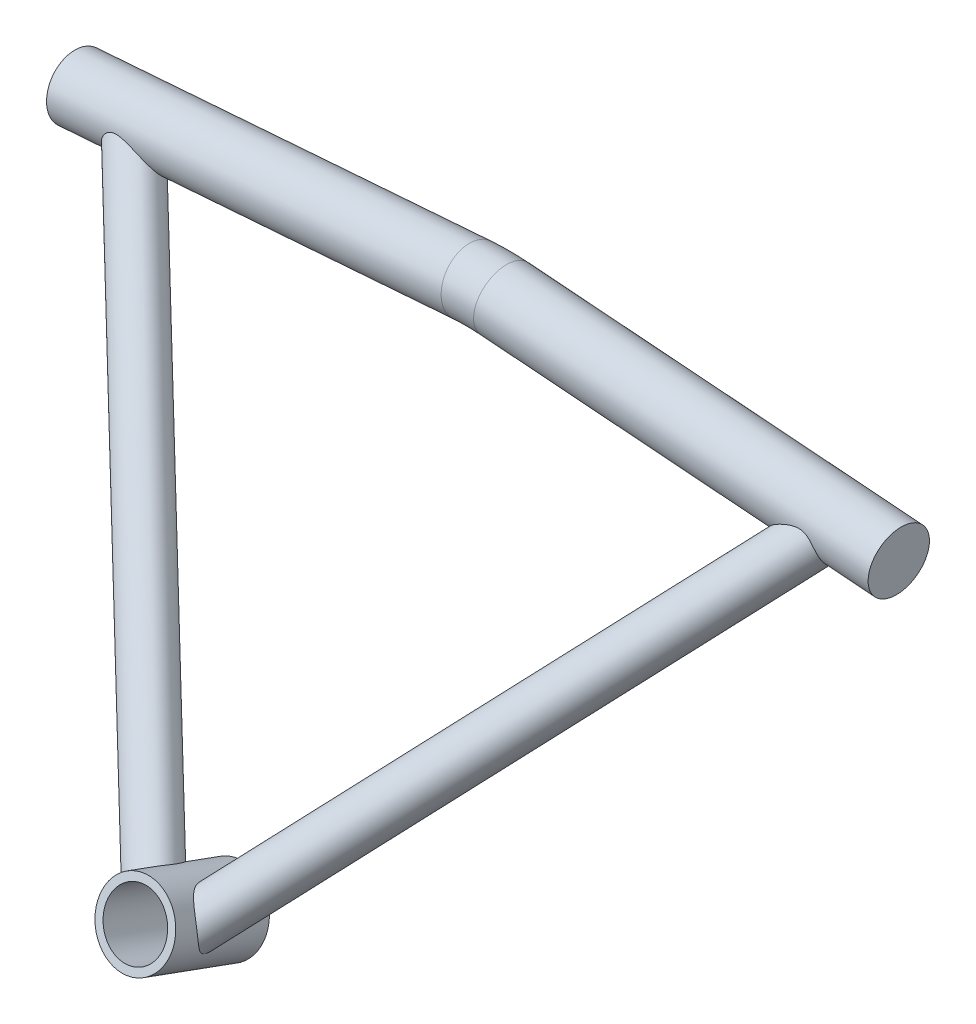
from build123d import *

# Parameters (mm, degrees)
SKETCH1_R               = 15.875
BOSS_EXTRUDE1_DEPTH     = 20.701
SWEEP1_PROFILE_R        = 9.525
SWEEP2_PROFILE_R        = 9.525
CUT_EXTRUDE2_REACH      = 371.805
SKETCH36_R              = 7.9375
CUT_EXTRUDE3_REACH      = 371.805
CUT_EXTRUDE3_END_RADIUS = 15.875
SKETCH37_R              = 7.9375
SKETCH77_R              = 15.875
BOSS_EXTRUDE2_DEPTH     = 41.402
CUT_EXTRUDE1_REACH      = 251.445
SKETCH2_R               = 12.7
SWEEP3_PROFILE_R        = 12.7


with BuildPart() as part:
    # Sketch1 → Boss-Extrude1 (new, symmetric)
    with BuildSketch(Plane(origin=(0, 0, 0), x_dir=(1, 0, 0), z_dir=(0, 0.34202014332566943, 0.9396926207859081))):
        with Locations(Location((0, 0, 0), (0, 0, 270))):
            Circle(SKETCH1_R)
    extrude(amount=BOSS_EXTRUDE1_DEPTH, both=True)

    # Sweep1: sweep along a path in Sketch4
    with BuildLine(Plane(origin=(0, 3.144101118, 3.616874596), x_dir=(1, 0, 0), z_dir=(0, 0.6560590289905084, 0.754709580222771))) as sweep1_path:
        Line((-5.08, -4.165974834), (-143.483994092, 193.495413453))
    # Sweep1 profile (on start of the path) → Sweep1 (sweep)
    with BuildSketch(Plane(origin=(-5.08, 0, 6.35), x_dir=(0.7330812283825076, 0.6801410975622587, 0), z_dir=(-0.5735764363510472, 0.6182218954839692, -0.5374120947718255))):
        Circle(SWEEP1_PROFILE_R)
    sweep(path=sweep1_path.line)

    # Sweep2: sweep along a path in Sketch15
    with BuildLine(Plane(origin=(0, 3.144101118, 3.616874596), x_dir=(1, 0, 0), z_dir=(0, 0.6560590289905084, 0.754709580222771))) as sweep2_path:
        Line((5.08, -4.165974834), (143.483994092, 193.495413453))
    # Sweep2 profile (on start of the path) → Sweep2 (sweep)
    with BuildSketch(Plane(origin=(5.08, 0, 6.35), x_dir=(0.7330812283825074, -0.6801410975622589, 0), z_dir=(0.5735764363510474, 0.6182218954839692, -0.5374120947718254))):
        Circle(SWEEP2_PROFILE_R)
    sweep(path=sweep2_path.line)

    # Sketch36 → Cut-Extrude2 (cut, up to next)
    with BuildSketch(Plane(origin=(-138.117895022, 148.868575223, -129.409478119), x_dir=(0.8191108775847741, 0.4394391101382058, -0.36871484741361205), z_dir=(-0.5735764363510472, 0.6182218954839691, -0.5374120947718255)), mode=Mode.PRIVATE) as cut_extrude2_sk1:
        with Locations(Location((-6.502422539, -4.857839146, 0), (0, 0, 154.073467295))):
            Circle(SKETCH36_R)
    cut_extrude2_tool1 = extrude(cut_extrude2_sk1.sketch, amount=-CUT_EXTRUDE2_REACH, mode=Mode.PRIVATE) & part.part
    add(cut_extrude2_tool1.solids().sort_by_distance((-143.483994, 149.176943, -123.327538))[0], mode=Mode.SUBTRACT)

    # Cut-Extrude3: up to this cylinder (the profile starts outside it)
    cut_extrude3_end = Plane(origin=(0, -22.186319293, -60.956411279), z_dir=(0, -0.34202014332566943, -0.9396926207859081)) * Cylinder(CUT_EXTRUDE3_END_RADIUS, 776.36, mode=Mode.PRIVATE)
    # Sketch37 → Cut-Extrude3 (cut, up to the surface)
    with BuildSketch(Plane(origin=(138.117895022, 148.868575223, -129.409478119), x_dir=(0.8191108775847737, -0.4394391101382061, 0.36871484741361227), z_dir=(0.5735764363510476, 0.6182218954839689, -0.5374120947718255)), mode=Mode.PRIVATE) as cut_extrude3_sk1:
        with Locations(Location((6.502422539, -4.857839146, 0), (0, 0, 205.926532705))):
            Circle(SKETCH37_R)
    cut_extrude3_tool1 = extrude(cut_extrude3_sk1.sketch, amount=-CUT_EXTRUDE3_REACH, mode=Mode.PRIVATE) - cut_extrude3_end
    add(cut_extrude3_tool1.solids().sort_by_distance((143.483994, 149.176943, -123.327538))[0], mode=Mode.SUBTRACT)

    # Sketch77 → Boss-Extrude2 (add)
    with BuildSketch(Plane(origin=(0, 7.080158987, 19.452576943), x_dir=(1, 0, 0), z_dir=(0, 0.34202014332566943, 0.9396926207859082))):
        with Locations(Location((0, 0, 0), (0, 0, 270))):
            Circle(SKETCH77_R)
    extrude(amount=-BOSS_EXTRUDE2_DEPTH)

    # Sketch2 → Cut-Extrude1 (cut, up to next)
    with BuildSketch(Plane(origin=(0, -7.080158987, -19.452576943), x_dir=(-1, 0, 0), z_dir=(0, -0.34202014332566943, -0.9396926207859081)), mode=Mode.PRIVATE) as cut_extrude1_sk1:
        with Locations(Location((0, 0, 0), (0, 0, 90))):
            Circle(SKETCH2_R)
    cut_extrude1_tool1 = extrude(cut_extrude1_sk1.sketch, amount=-CUT_EXTRUDE1_REACH, mode=Mode.PRIVATE) & part.part
    add(cut_extrude1_tool1.solids().sort_by_distance((0, -7.080159, -19.452577))[0], mode=Mode.SUBTRACT)

    # Sweep3: sweep along a path in Sketch40
    with BuildLine(Plane(origin=(-106.934, 0, -127), x_dir=(1, 0, 0), z_dir=(0, 0, 1))) as sweep3_path:
        Line((-63.663829669, 149.860844852), (100.20235662, 162.304768472))
        ThreePointArc((100.20235662, 162.304768472), (106.934, 162.56), (113.66564338, 162.304768472))
        Line((113.66564338, 162.304768472), (277.531829669, 149.860844852))
    # Sweep3 profile (on start of the path) → Sweep3 (sweep)
    with BuildSketch(Plane(origin=(-170.597829669, 149.860844852, -127), x_dir=(-0.07572152283577545, 0.9971290041812199, 0), z_dir=(0.9971290041812199, 0.07572152283577545, 0))):
        Circle(SWEEP3_PROFILE_R)
    sweep(path=sweep3_path.line)


solid = part.part
